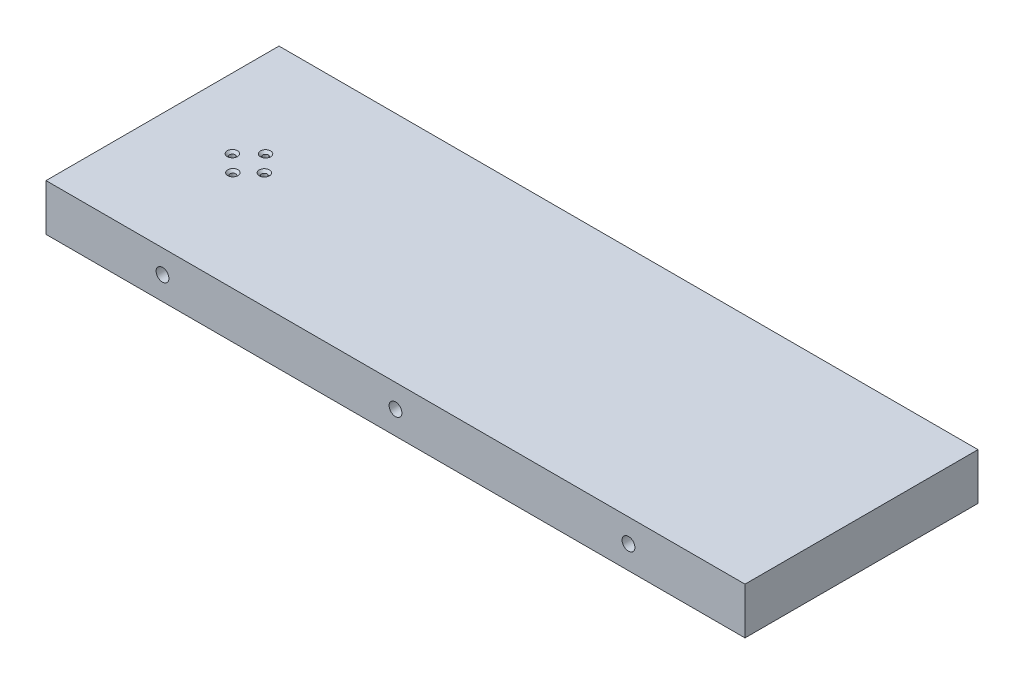
from build123d import *

# Parameters (mm, degrees)
SKETCH4_W                                       = 300
SKETCH4_H                                       = 100
BOSS_EXTRUDE2_DEPTH                             = 20
CSK_FOR_M2_FLAT_HEAD_MACHINE_SCREW1_D           = 2.4
CSK_FOR_M2_FLAT_HEAD_MACHINE_SCREW1_CSINK_D     = 4.4
CSK_FOR_M2_FLAT_HEAD_MACHINE_SCREW1_CSINK_ANGLE = 90
CBORE_FOR_M5_HEX_HEAD_BOLT1_D                   = 5.5
CBORE_FOR_M5_HEX_HEAD_BOLT1_CBORE_D             = 12.24
CBORE_FOR_M5_HEX_HEAD_BOLT1_CBORE_DEPTH         = 3.58


with BuildPart() as part:
    # Sketch4 → Boss-Extrude2 (new body)
    with BuildSketch(Plane(origin=(0, 0, 0), x_dir=(1, 0, 0), z_dir=(0, 1, 0))):
        Rectangle(SKETCH4_W, SKETCH4_H)
    extrude(amount=BOSS_EXTRUDE2_DEPTH)

    # CSK for M2 Flat Head Machine Screw1 (through all)
    with Locations(Plane(origin=(0, 20, 0), x_dir=(1, 0, 0), z_dir=(0, 1, 0))):
        with Locations((-120, 0), (-106, -0.273765591), (-112.818119913, 7.041508898), (-112.818119913, -6.958491102)):
            CounterSinkHole(CSK_FOR_M2_FLAT_HEAD_MACHINE_SCREW1_D / 2, CSK_FOR_M2_FLAT_HEAD_MACHINE_SCREW1_CSINK_D / 2, counter_sink_angle=CSK_FOR_M2_FLAT_HEAD_MACHINE_SCREW1_CSINK_ANGLE)

    # CBORE for M5 Hex Head Bolt1 (through all)
    with Locations(Plane(origin=(0, 0, -50), x_dir=(-1, 0, 0), z_dir=(0, 0, -1))):
        with Locations((0, 10), (-100, 10), (100, 10)):
            CounterBoreHole(CBORE_FOR_M5_HEX_HEAD_BOLT1_D / 2, CBORE_FOR_M5_HEX_HEAD_BOLT1_CBORE_D / 2, CBORE_FOR_M5_HEX_HEAD_BOLT1_CBORE_DEPTH)


solid = part.part
